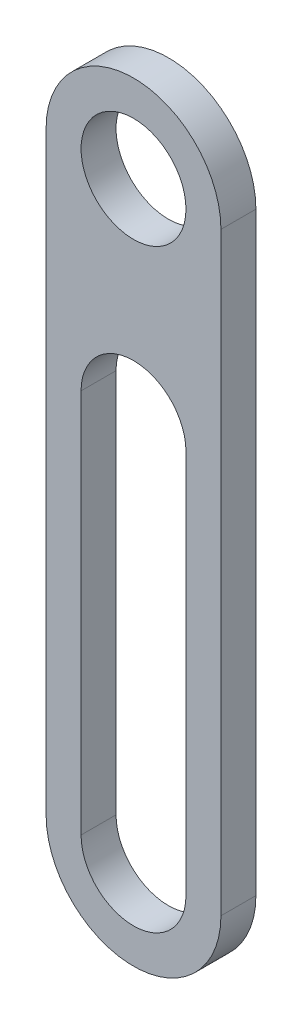
from build123d import *

# Parameters (mm, degrees)
SKETCH1_R           = 1.5
BOSS_EXTRUDE1_DEPTH = 1


with BuildPart() as part:
    # Sketch1 → Boss-Extrude1 (new body)
    with BuildSketch(Plane.XY):
        with BuildLine():
            Line((-2.5, 11.5), (-2.5, -5.5))
            ThreePointArc((-2.5, -5.5), (0, -8), (2.5, -5.5))
            Line((2.5, -5.5), (2.5, 11.5))
            ThreePointArc((2.5, 11.5), (0, 14), (-2.5, 11.5))
        make_face()
        with Locations((0, 11.5)):
            Circle(SKETCH1_R, mode=Mode.SUBTRACT)
        with BuildLine():
            Line((-1.5, -5.5), (-1.5, 5.5))
            ThreePointArc((-1.5, 5.5), (0, 7), (1.5, 5.5))
            Line((1.5, 5.5), (1.5, -5.5))
            ThreePointArc((1.5, -5.5), (0, -7), (-1.5, -5.5))
        make_face(mode=Mode.SUBTRACT)
    extrude(amount=BOSS_EXTRUDE1_DEPTH)


solid = part.part
